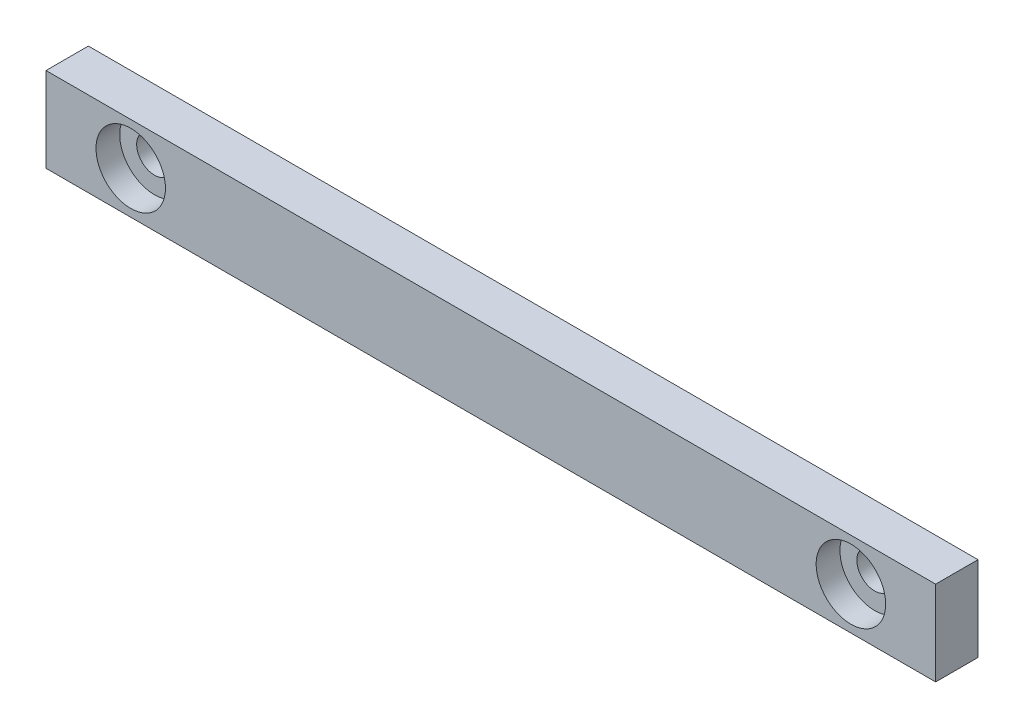
from build123d import *

# Parameters (mm, degrees)
SKETCH_1_W          = 105
SKETCH_1_H          = 10
SKETCH_1_R          = 2.1
EXTRUDE_1_DEPTH     = 5
SKETCH_2_R          = 4.1
CUT_EXTRUDE_1_DEPTH = 2.8


with BuildPart() as part:
    # 草圖1 → 填料-伸長1 (new body)
    with BuildSketch(Plane.XY):
        with Locations((3.82243685, 4.907132244)):
            Rectangle(SKETCH_1_W, SKETCH_1_H)
        with Locations((-38.67756315, 4.907132244)):
            Circle(SKETCH_1_R, mode=Mode.SUBTRACT)
        with Locations((46.32243685, 4.907132244)):
            Circle(SKETCH_1_R, mode=Mode.SUBTRACT)
    extrude(amount=EXTRUDE_1_DEPTH)

    # 草圖2 → 除料-伸長1 (cut)
    with BuildSketch(Plane.XY.offset(5)):
        with Locations((-38.67756315, 4.907132244)):
            Circle(SKETCH_2_R)
        with Locations((46.32243685, 4.907132244)):
            Circle(SKETCH_2_R)
    extrude(amount=-CUT_EXTRUDE_1_DEPTH, mode=Mode.SUBTRACT)


solid = part.part
